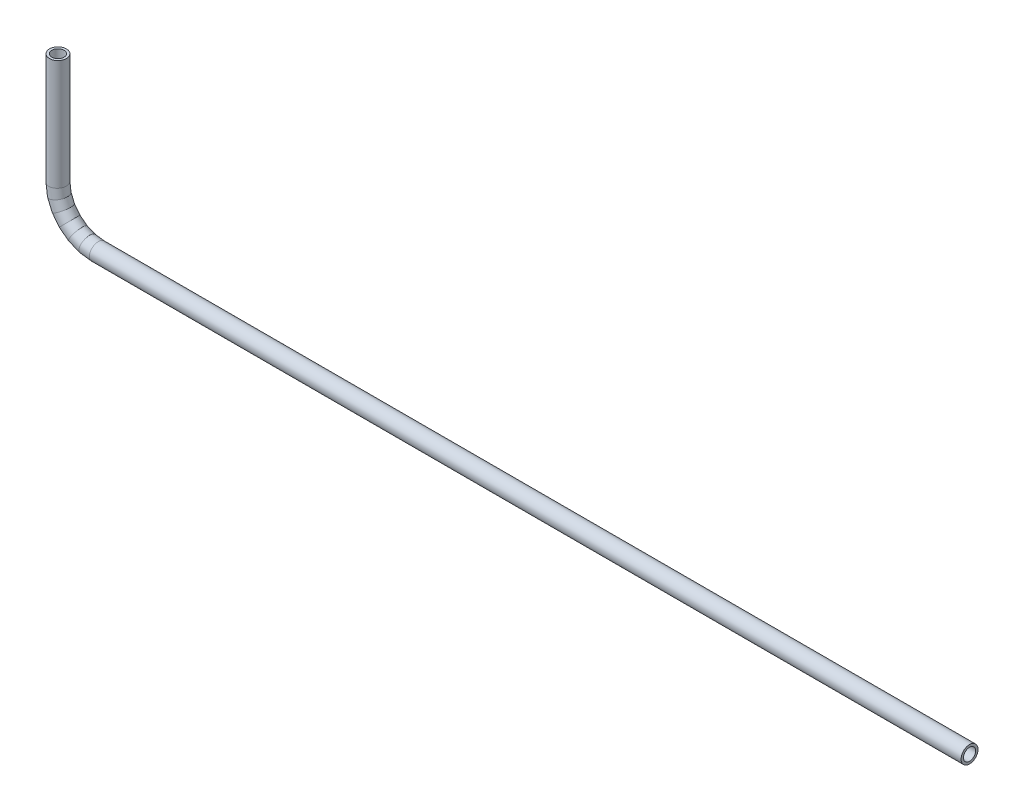
from build123d import *

# Parameters (mm, degrees)
PROFILE_R   = 3.175
PROFILE_R_2 = 2.286


with BuildPart() as part:
    # Tube: sweep along a curve in space
    with BuildLine() as tube_path:
        Line((-3361.642778381, -88, 0), (-3689.192778381, -88, 0))
        Line((-3689.192778381, -88, 0), (-3693.075064057, -87.488887394, 0))
        Line((-3693.075064057, -87.488887394, 0), (-3696.692778381, -85.990381057, 0))
        Line((-3696.692778381, -85.990381057, 0), (-3699.799380099, -83.606601718, 0))
        Line((-3699.799380099, -83.606601718, 0), (-3702.183159438, -80.5, 0))
        Line((-3702.183159438, -80.5, 0), (-3703.681665775, -76.882285677, 0))
        Line((-3703.681665775, -76.882285677, 0), (-3704.192778381, -73, 0))
        Line((-3704.192778381, -73, 0), (-3704.192778381, -31.3, 0))
    # Profile → Tube (sweep)
    with BuildSketch(Plane(origin=(-3361.642778381, 0, 0), x_dir=(0, 0, -1), z_dir=(1, 0, 0))):
        with Locations((0, -88)):
            Circle(PROFILE_R)
        with Locations((0, -88)):
            Circle(PROFILE_R_2, mode=Mode.SUBTRACT)
    sweep(path=tube_path.line, transition=Transition.RIGHT)


solid = part.part
